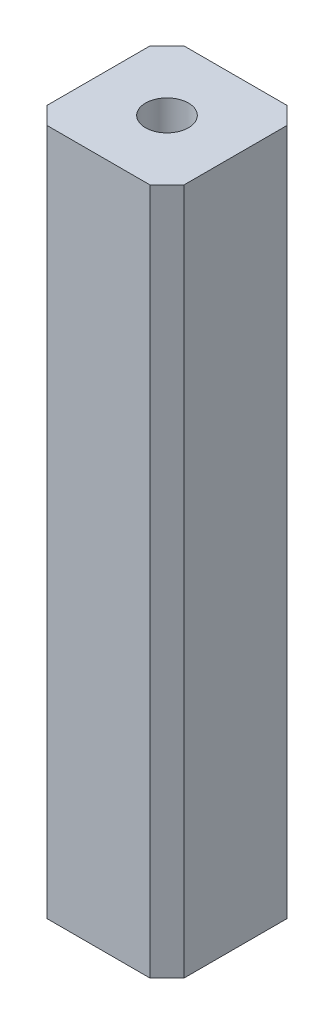
from build123d import *

# Parameters (mm, degrees)
SKETCH_1_W        = 8
SKETCH_1_H        = 8
SKETCH_1_R        = 1.25
EXTRUDE_349_DEPTH = 40
CHAMFER_1_SIZE    = 1


with BuildPart() as part:
    # Эскиз1 → Extrude 349 (new body)
    with BuildSketch(Plane(origin=(0, 0, 0), x_dir=(1, 0, 0), z_dir=(0, 1, 0))):
        Rectangle(SKETCH_1_W, SKETCH_1_H)
        with Locations(Location((0, 0, 0), (0, 0, 270))):
            Circle(SKETCH_1_R, mode=Mode.SUBTRACT)
    extrude(amount=EXTRUDE_349_DEPTH)

    # Фаска1
    chamfer_1_edges = [part.edges().sort_by_distance(p)[0] for p in [
        (4, 20, 4),
        (-4, 20, 4),
        (-4, 20, -4),
        (4, 20, -4),
    ]]
    chamfer(chamfer_1_edges, length=CHAMFER_1_SIZE)


solid = part.part
